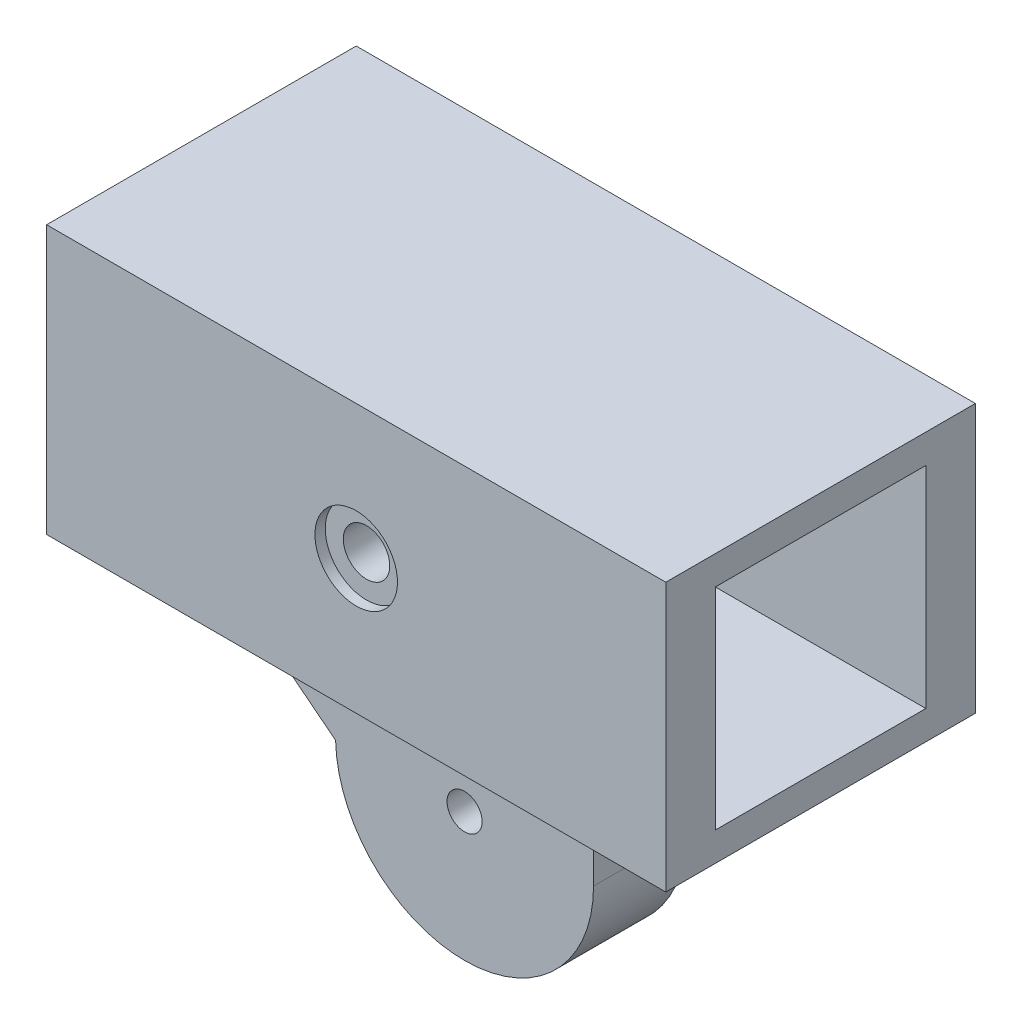
from build123d import *

# Parameters (mm, degrees)
ESQUISSE1_W                                        = 30
ESQUISSE1_H                                        = 26
BOSS_EXTRU_1_DEPTH                                 = 60
BOSS_EXTRU_2_DEPTH                                 = 4.5
ESQUISSE3_W                                        = 20.4
ESQUISSE3_H                                        = 20.4
ENL_V_MAT_EXTRU_1_DEPTH                            = 60
D_GAGEMENT_M31_D                                   = 3.4
NERVURE3_REACH                                     = 69.089
ESQUISSE7_WALL_W                                   = 158.445223638
ESQUISSE7_WALL_H                                   = 9
CHAMBRAGE_POUR_VIS_T_TE_HEXAGONALE_M41_D           = 4.5
CHAMBRAGE_POUR_VIS_T_TE_HEXAGONALE_M41_DEPTH       = 4.8
CHAMBRAGE_POUR_VIS_T_TE_HEXAGONALE_M41_CBORE_D     = 8
CHAMBRAGE_POUR_VIS_T_TE_HEXAGONALE_M41_CBORE_DEPTH = 1


with BuildPart() as part:
    # Esquisse1 → Boss.-Extru.1 (new body)
    with BuildSketch(Plane(origin=(0, 0, 0), x_dir=(0, 0, -1), z_dir=(1, 0, 0))):
        with Locations((0, 13)):
            Rectangle(ESQUISSE1_W, ESQUISSE1_H)
    extrude(amount=BOSS_EXTRU_1_DEPTH)

    # Esquisse4 → Boss.-Extru.2 (add, symmetric)
    with BuildSketch(Plane.XY):
        with BuildLine():
            Line((17.5, 0), (17.5, -13.5))
            ThreePointArc((17.5, -13.5), (30, -26), (42.5, -13.5))
            Line((42.5, -13.5), (42.5, 0))
            Line((42.5, 0), (17.5, 0))
        make_face()
    extrude(amount=BOSS_EXTRU_2_DEPTH, both=True)

    # Esquisse3 → Enlèv. mat.-Extru.1 (cut)
    with BuildSketch(Plane.ZY):
        with Locations((0, 13)):
            Rectangle(ESQUISSE3_W, ESQUISSE3_H)
    extrude(amount=-ENL_V_MAT_EXTRU_1_DEPTH, mode=Mode.SUBTRACT)

    # Dégagement M31 (through all)
    with Locations(Plane.XY.offset(4.5)):
        with Locations((30, -13.5)):
            Hole(D_GAGEMENT_M31_D / 2)

    # Esquisse7 wall → Nervure3 (add, up to next)
    with BuildSketch(Plane(origin=(8.75, -6.883592551, 0), x_dir=(0.785943249757, -0.618298639947, 0), z_dir=(0.618298639947, 0.785943249757, 0)), mode=Mode.PRIVATE) as nervure3_sk1:
        Rectangle(ESQUISSE7_WALL_W, ESQUISSE7_WALL_H)
    nervure3_tool1 = extrude(nervure3_sk1.sketch, amount=NERVURE3_REACH, mode=Mode.PRIVATE) - part.part
    add(nervure3_tool1.solids().sort_by_distance((8.75, -6.883592551, 0))[0])

    # Chambrage pour vis à tête hexagonale M41
    with Locations(Plane.XY.offset(15)):
        with Locations((30, 13)):
            chambrage_pour_vis_t_te_hexagonale_m41 = CounterBoreHole(CHAMBRAGE_POUR_VIS_T_TE_HEXAGONALE_M41_D / 2, CHAMBRAGE_POUR_VIS_T_TE_HEXAGONALE_M41_CBORE_D / 2, CHAMBRAGE_POUR_VIS_T_TE_HEXAGONALE_M41_CBORE_DEPTH, depth=CHAMBRAGE_POUR_VIS_T_TE_HEXAGONALE_M41_DEPTH)

    # Symétrie1: Chambrage pour vis à tête hexagonale M41 across plane
    add(chambrage_pour_vis_t_te_hexagonale_m41.mirror(Plane.XY), mode=Mode.SUBTRACT)


solid = part.part
